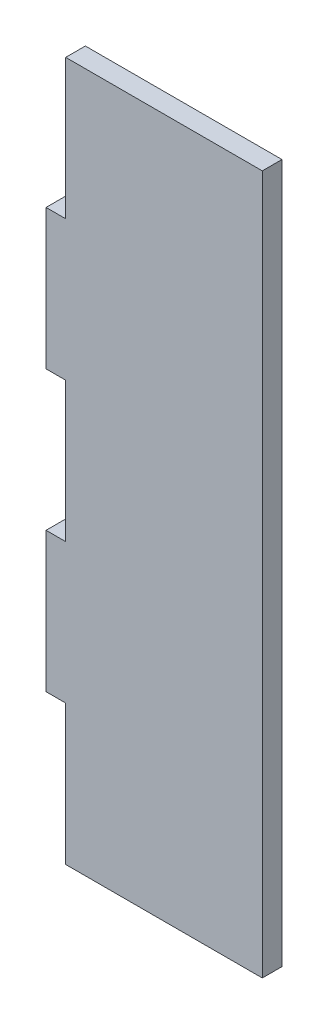
from build123d import *

# Parameters (mm, degrees)
BOSS_EXTRUDE1_DEPTH = 9


with BuildPart() as part:
    # Sketch2 → Boss-Extrude1 (new body)
    with BuildSketch(Plane.XY):
        Polygon((0, 256), (0, 320), (90, 320), (90, 0), (0, 0), (0, 64), (-9, 64), (-9, 128), (0, 128), (0, 192), (-9, 192), (-9, 256), align=None)
    extrude(amount=BOSS_EXTRUDE1_DEPTH)


solid = part.part
